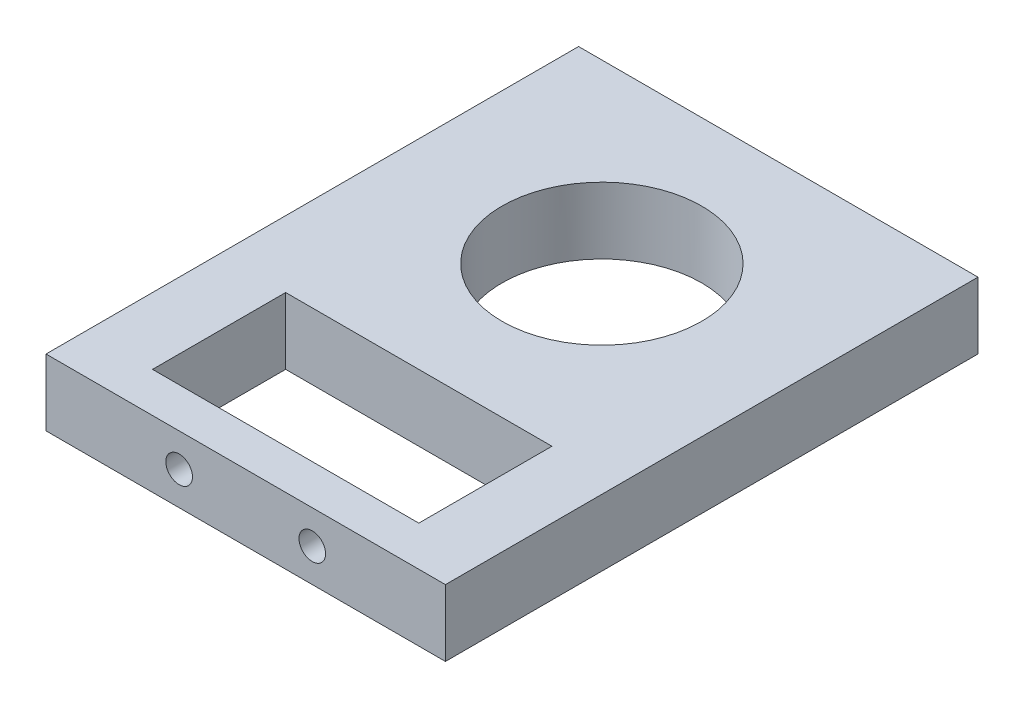
from build123d import *

# Parameters (mm, degrees)
SKETCH1_W           = 60
SKETCH1_H           = 80
BOSS_EXTRUDE1_DEPTH = 10
SKETCH2_R           = 15
CUT_EXTRUDE1_DEPTH  = 80
SKETCH3_W           = 40
SKETCH3_H           = 20
CUT_EXTRUDE2_DEPTH  = 80
SKETCH4_R           = 2
CUT_EXTRUDE3_DEPTH  = 10


with BuildPart() as part:
    # Sketch1 → Boss-Extrude1 (new body)
    with BuildSketch(Plane(origin=(0, 0, 0), x_dir=(1, 0, 0), z_dir=(0, 1, 0))):
        Rectangle(SKETCH1_W, SKETCH1_H)
    extrude(amount=BOSS_EXTRUDE1_DEPTH)

    # Sketch2 → Cut-Extrude1 (cut)
    with BuildSketch(Plane(origin=(0, 10, 0), x_dir=(1, 0, 0), z_dir=(0, 1, 0))):
        with Locations(Location((0, 13.5, 0), (0, 0, 270))):
            Circle(SKETCH2_R)
    extrude(amount=-CUT_EXTRUDE1_DEPTH, mode=Mode.SUBTRACT)

    # Sketch3 → Cut-Extrude2 (cut)
    with BuildSketch(Plane(origin=(0, 10, 0), x_dir=(1, 0, 0), z_dir=(0, 1, 0))):
        with Locations((0, -24)):
            Rectangle(SKETCH3_W, SKETCH3_H)
    extrude(amount=-CUT_EXTRUDE2_DEPTH, mode=Mode.SUBTRACT)

    # Sketch4 → Cut-Extrude3 (cut)
    with BuildSketch(Plane(origin=(0, 0, 34), x_dir=(-1, 0, 0), z_dir=(0, 0, -1))):
        with Locations((10, 5)):
            Circle(SKETCH4_R)
        with Locations((-10, 5)):
            Circle(SKETCH4_R)
    extrude(amount=-CUT_EXTRUDE3_DEPTH, mode=Mode.SUBTRACT)


solid = part.part
